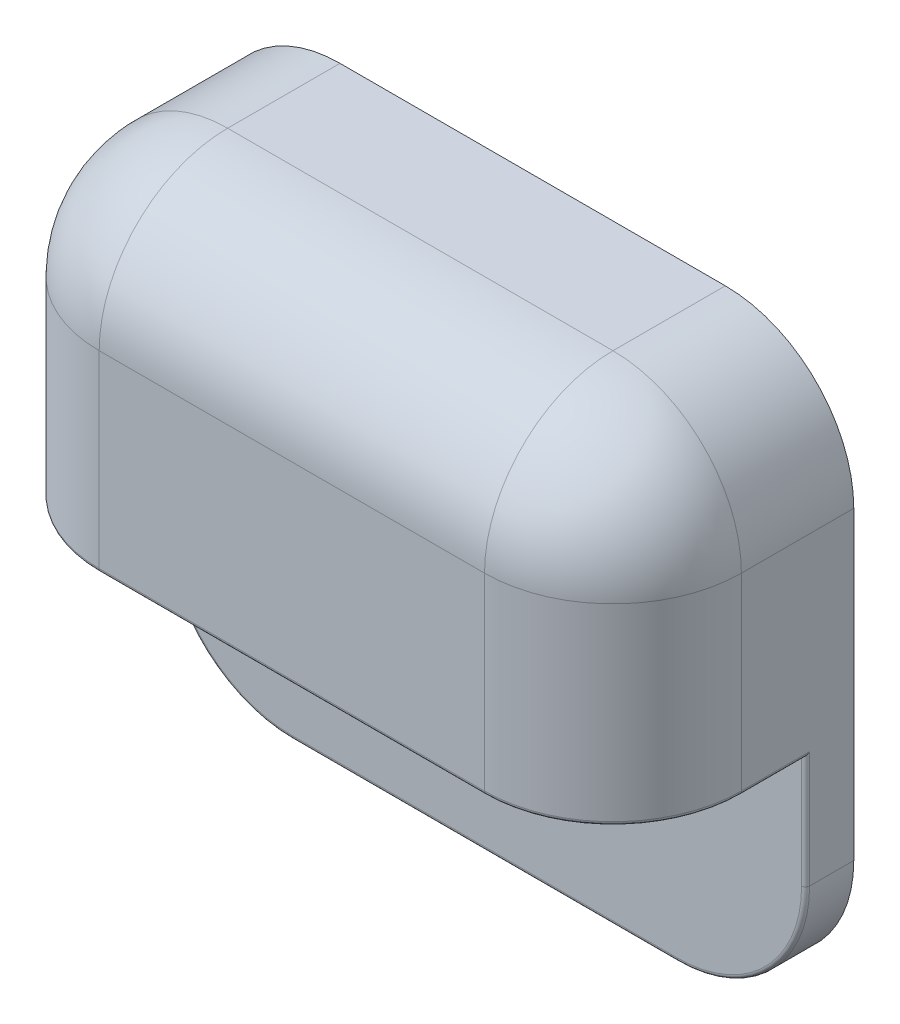
from build123d import *

# Parameters (mm, degrees)
BOSS_EXTRU_1_DEPTH      = 4
BOSS_EXTRU_1_DEPTH_BACK = 8
ESQUISSE1_W             = 40
ESQUISSE1_H             = 20
ESQUISSE2_R             = 2.65
ENL_V_MAT_EXTRU_1_DEPTH = 14.5
CONG_1_R                = 8
CONG_2_R                = 0.25
ESQUISSE3_W             = 40
ESQUISSE3_H             = 35
BOSS_EXTRU_2_DEPTH      = 3
CONG_3_R                = 8
CONG_4_R                = 0.25


with BuildPart() as part:
    # Esquisse1 → Boss.-Extru.1 (new, two sides: drawn at the far end of the back side and taken through both)
    with BuildSketch(Plane.XY.offset(-BOSS_EXTRU_1_DEPTH_BACK)):
        Rectangle(ESQUISSE1_W, ESQUISSE1_H)
    extrude(amount=BOSS_EXTRU_1_DEPTH + BOSS_EXTRU_1_DEPTH_BACK)

    # Esquisse2 → Enlèv. mat.-Extru.1 (cut)
    with BuildSketch(Plane.XZ.offset(10)):
        with Locations(Location((-13.776114995, -2, 0), (0, 0, 270))):
            Circle(ESQUISSE2_R)
        with Locations(Location((-4.776114995, -2, 0), (0, 0, 270))):
            Circle(ESQUISSE2_R)
        with Locations(Location((4.223885005, -2, 0), (0, 0, 270))):
            Circle(ESQUISSE2_R)
        with Locations(Location((13.223885005, -2, 0), (0, 0, 270))):
            Circle(ESQUISSE2_R)
    extrude(amount=-ENL_V_MAT_EXTRU_1_DEPTH, mode=Mode.SUBTRACT)

    # Congé1
    cong_1_edges = [part.edges().sort_by_distance(p)[0] for p in [
        (20, 0, 4),
        (-20, 0, 4),
    ]]
    fillet(cong_1_edges, radius=CONG_1_R)

    # Congé2
    cong_2_edges = [part.edges().sort_by_distance(p)[0] for p in [
        (-13.776114995, -10, 0.65),
        (-4.776114995, -10, 0.65),
        (4.223885005, -10, 0.65),
        (13.223885005, -10, 0.65),
    ]]
    fillet(cong_2_edges, radius=CONG_2_R)

    # Esquisse3 → Boss.-Extru.2 (add)
    with BuildSketch(Plane(origin=(0, 0, -8), x_dir=(-1, 0, 0), z_dir=(0, 0, -1))):
        with Locations((0, -7.5)):
            Rectangle(ESQUISSE3_W, ESQUISSE3_H)
    extrude(amount=BOSS_EXTRU_2_DEPTH)

    # Congé3
    cong_3_edges = [part.edges().sort_by_distance(p)[0] for p in [
        (0, 10, 4),
        (17.656854249, 10, 1.656854249),
        (-17.656854249, 10, 1.656854249),
        (-20, -25, -9.5),
        (20, -25, -9.5),
        (-20, 10, -7.5),
        (20, 10, -7.5),
    ]]
    fillet(cong_3_edges, radius=CONG_3_R)

    # Congé4
    cong_4_edges = [part.edges().sort_by_distance(p)[0] for p in [
        (0, -10, 4),
        (17.656854249, -10, 1.656854249),
        (-17.656854249, -10, 1.656854249),
        (20, -13.5, -8),
        (20, -10, -6),
        (-20, -10, -6),
        (-20, -13.5, -8),
        (0, -25, -8),
        (17.656854249, -22.656854249, -8),
        (-17.656854249, -22.656854249, -8),
    ]]
    fillet(cong_4_edges, radius=CONG_4_R)


solid = part.part
